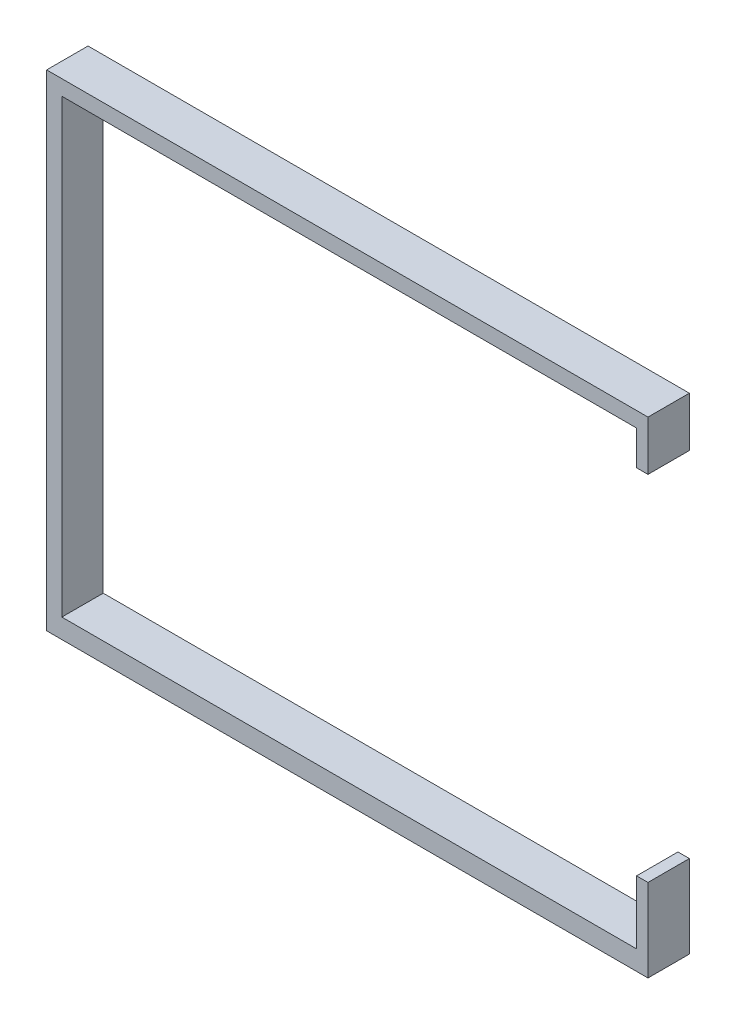
from build123d import *

# Parameters (mm, degrees)
SKETCH2_W           = 72.654814815
SKETCH2_H           = 58.693333333
SKETCH2_W_2         = 69.44
SKETCH2_H_2         = 54.5
BOSS_EXTRUDE1_DEPTH = 5
SKETCH3_W           = 5
SKETCH3_H           = 10
CUT_EXTRUDE1_DEPTH  = 10
CUT_EXTRUDE4_DEPTH  = 10


with BuildPart() as part:
    # Sketch2 → Boss-Extrude1 (new body)
    with BuildSketch(Plane.XY):
        with Locations((-0.551111111, -3.352592593)):
            Rectangle(SKETCH2_W, SKETCH2_H)
        with Locations((-0.321481481, -3.092962963)):
            Rectangle(SKETCH2_W_2, SKETCH2_H_2, mode=Mode.SUBTRACT)
    extrude(amount=BOSS_EXTRUDE1_DEPTH)

    # Sketch3 → Cut-Extrude1 (cut)
    with BuildSketch(Plane(origin=(35.776296296, 0, 0), x_dir=(0, 0, -1), z_dir=(1, 0, 0))):
        with Locations((-2.5, 14.994074074)):
            Rectangle(SKETCH3_W, SKETCH3_H)
    extrude(amount=-CUT_EXTRUDE1_DEPTH, mode=Mode.SUBTRACT)

    # Sketch4 → Cut-Extrude4 (cut)
    with BuildSketch(Plane(origin=(35.776296296, 0, 0), x_dir=(0, 0, -1), z_dir=(1, 0, 0))):
        Polygon((-5, -10.699259259), (-5, -22.699259259), (0, -22.699259259), (0, -10.699259259), (0, 9.994074074), (-5, 9.994074074), align=None)
    extrude(amount=-CUT_EXTRUDE4_DEPTH, mode=Mode.SUBTRACT)


solid = part.part
